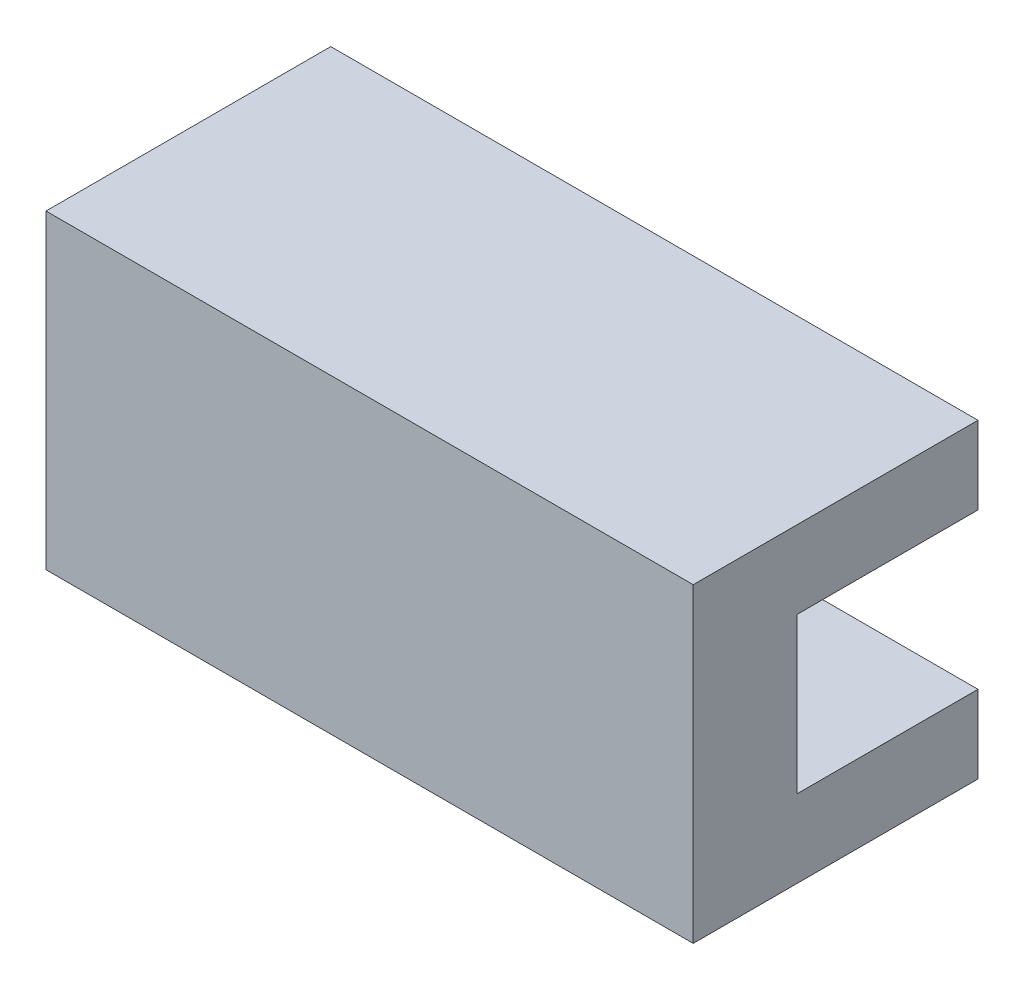
from build123d import *

# Parameters (mm, degrees)
EXTRUDE1_DEPTH = 50


with BuildPart() as part:
    # Sketch1 → Extrude1 (new body)
    with BuildSketch(Plane(origin=(0, 0, 0), x_dir=(0, 0, -1), z_dir=(1, 0, 0))):
        Polygon((24.881896552, 19.627298851), (2.881896552, 19.627298851), (2.881896552, -4.372701149), (24.881896552, -4.372701149), (24.881896552, 1.627298851), (10.881896552, 1.627298851), (10.881896552, 13.627298851), (24.881896552, 13.627298851), align=None)
    extrude(amount=EXTRUDE1_DEPTH)


solid = part.part
